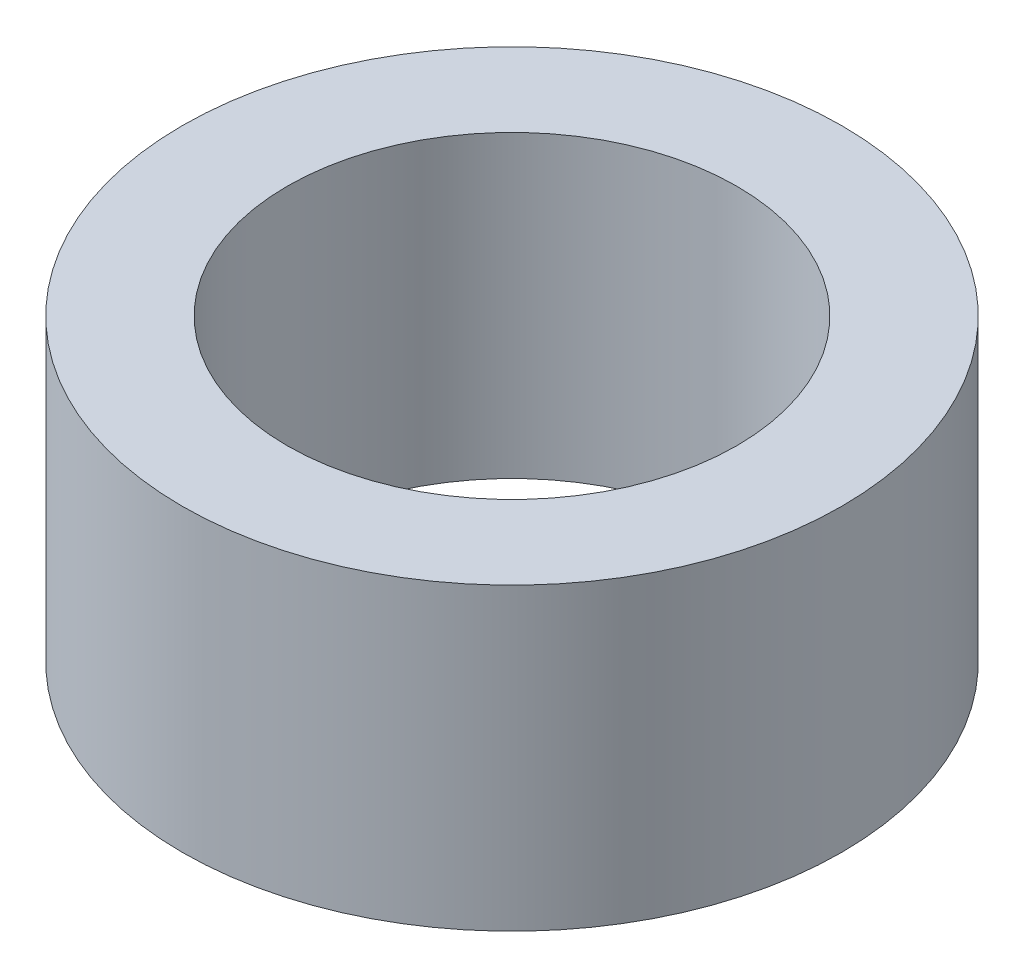
from build123d import *

# Parameters (mm, degrees)
SKETCH1_R           = 11
BOSS_EXTRUDE1_DEPTH = 10
SKETCH2_R           = 7.5
CUT_EXTRUDE1_DEPTH  = 10


with BuildPart() as part:
    # Sketch1 → Boss-Extrude1 (new body)
    with BuildSketch(Plane(origin=(0, 0, 0), x_dir=(1, 0, 0), z_dir=(0, 1, 0))):
        with Locations(Location((0, 0, 0), (0, 0, 270))):
            Circle(SKETCH1_R)
    extrude(amount=BOSS_EXTRUDE1_DEPTH)

    # Sketch2 → Cut-Extrude1 (cut)
    with BuildSketch(Plane(origin=(0, 10, 0), x_dir=(1, 0, 0), z_dir=(0, 1, 0))):
        with Locations(Location((0, 0, 0), (0, 0, 270))):
            Circle(SKETCH2_R)
    extrude(amount=-CUT_EXTRUDE1_DEPTH, mode=Mode.SUBTRACT)


solid = part.part
